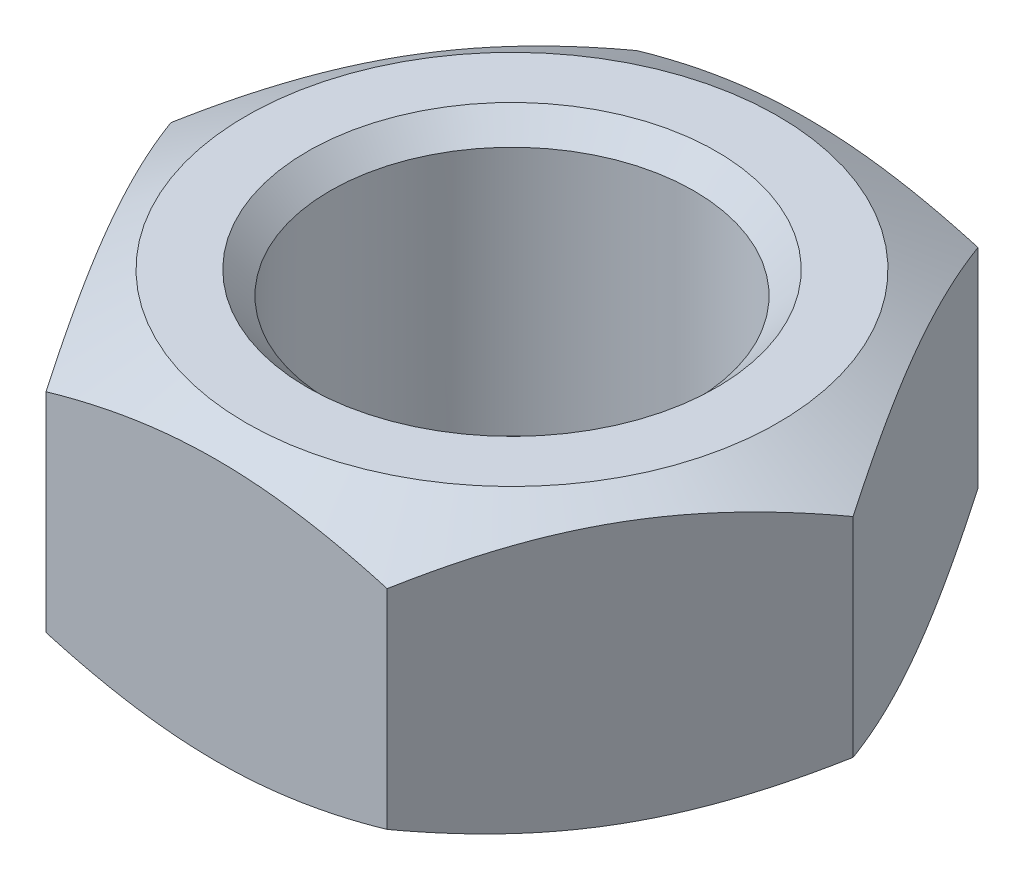
from build123d import *

# Parameters (mm, degrees)
EXTRUDE_1_DEPTH     = 6.5
SKETCH_5_R          = 4
CUT_EXTRUDE_1_DEPTH = 12.867322079
CHAMFER_1_SIZE      = 0.5


with BuildPart() as part:
    # Эскиз1 → Вытянуть1 (new body)
    with BuildSketch(Plane(origin=(0, 0, 0), x_dir=(1, 0, 0), z_dir=(0, 1, 0))):
        Polygon((-3.75277675, 6.5), (3.75277675, 6.5), (7.505553499, 0), (3.75277675, -6.5), (-3.75277675, -6.5), (-7.505553499, 0), align=None)
    extrude(amount=-EXTRUDE_1_DEPTH)

    # Эскиз5 → Вырез-Вытянуть1 (cut, through all)
    with BuildSketch(Plane.XZ.offset(6.5)):
        with Locations(Location((0, 0, 0), (0, 0, 270))):
            Circle(SKETCH_5_R)
    extrude(amount=-CUT_EXTRUDE_1_DEPTH, mode=Mode.SUBTRACT)

    # Эскиз4 → Вырез-Повернуть1 (revolve, cut)
    with BuildSketch(Plane.XY, mode=Mode.PRIVATE) as cut_revolve_1_sk:
        Polygon((-7.505553499, -0.955834259), (-5.85, 0), (-7.505553499, 0), align=None)
        Polygon((-7.505553499, -5.544165741), (-5.85, -6.5), (-7.505553499, -6.5), align=None)
    revolve(cut_revolve_1_sk.sketch.rotate(Axis((0, 0, 0), (0, -1, 0)), 119.999999999), axis=Axis((0, 0, 0), (0, -1, 0)), mode=Mode.SUBTRACT)

    # Фаска1
    chamfer_1_edges = [part.edges().sort_by_distance(p)[0] for p in [
        (0, 0, 4),
        (0, -6.5, 4),
    ]]
    chamfer(chamfer_1_edges, length=CHAMFER_1_SIZE)


solid = part.part
